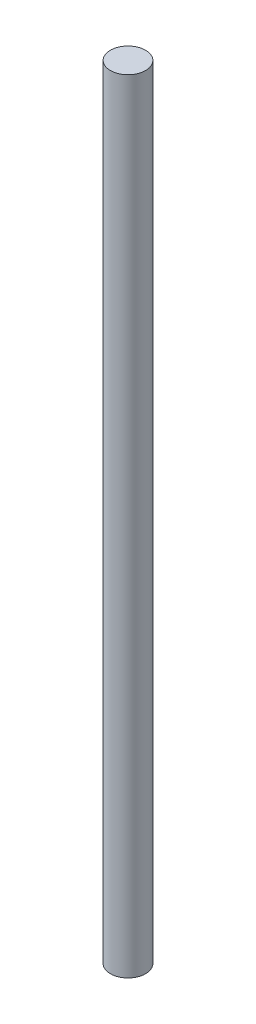
from build123d import *

# Parameters (mm, degrees)
SKETCH2_R = 6.75


with BuildPart() as part:
    # Sweep1: sweep along a path in Sketch1
    with BuildLine(Plane.XY) as sweep1_path:
        Line((0, 0), (0, 300))
    # Sketch2 → Sweep1 (sweep)
    with BuildSketch(Plane(origin=(0, 0, 0), x_dir=(1, 0, 0), z_dir=(0, 1, 0))):
        Circle(SKETCH2_R)
    sweep(path=sweep1_path.line)


solid = part.part
